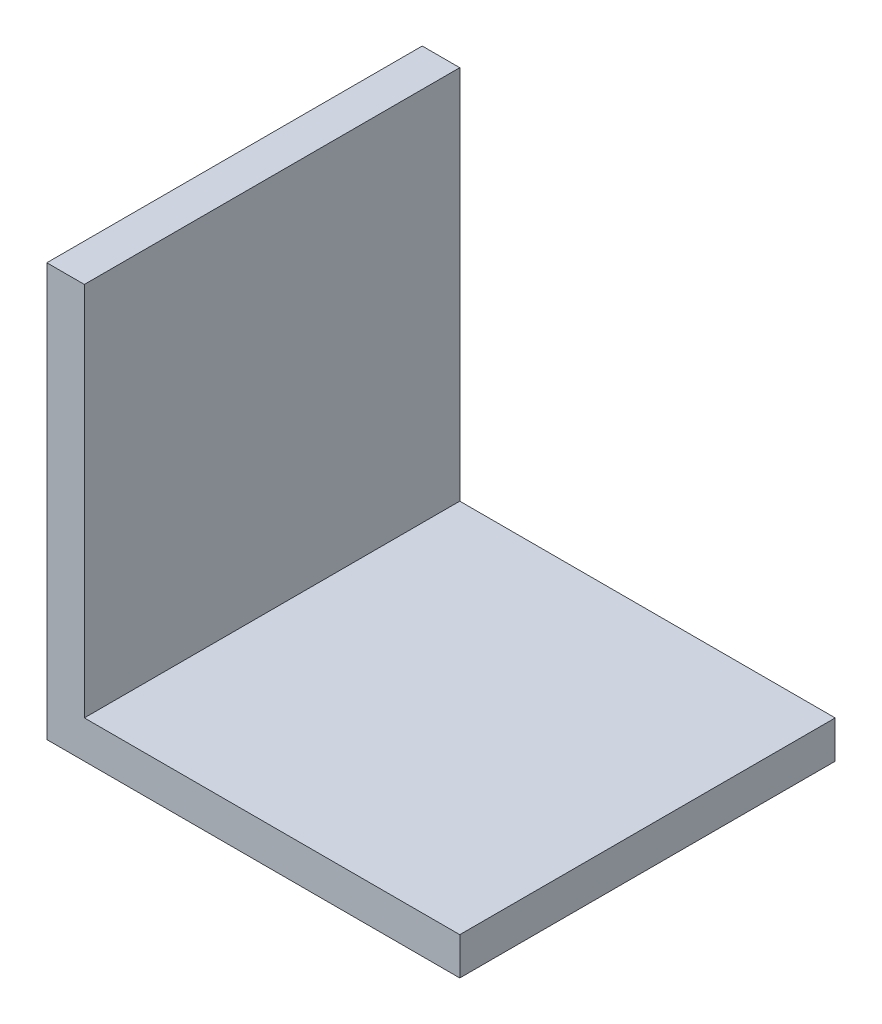
from build123d import *

# Parameters (mm, degrees)
EXTRUDE_1_DEPTH = 30


with BuildPart() as part:
    # Эскиз1 → Вытянуть-Тонкостенный1 (new body)
    with BuildSketch(Plane.XY):
        Polygon((0, 30), (0, 0), (30, 0), (30, -3), (-3, -3), (-3, 30), align=None)
    extrude(amount=-EXTRUDE_1_DEPTH)


solid = part.part
